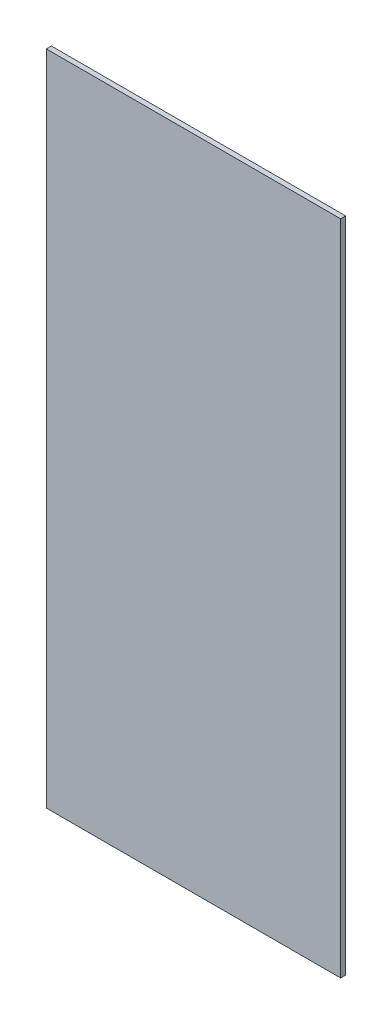
from build123d import *

# Parameters (mm, degrees)
SKETCH1_W           = 235
SKETCH1_H           = 525
BOSS_EXTRUDE1_DEPTH = 4


with BuildPart() as part:
    # Sketch1 → Boss-Extrude1 (new body)
    with BuildSketch(Plane.XY):
        Rectangle(SKETCH1_W, SKETCH1_H)
    extrude(amount=BOSS_EXTRUDE1_DEPTH)


solid = part.part
